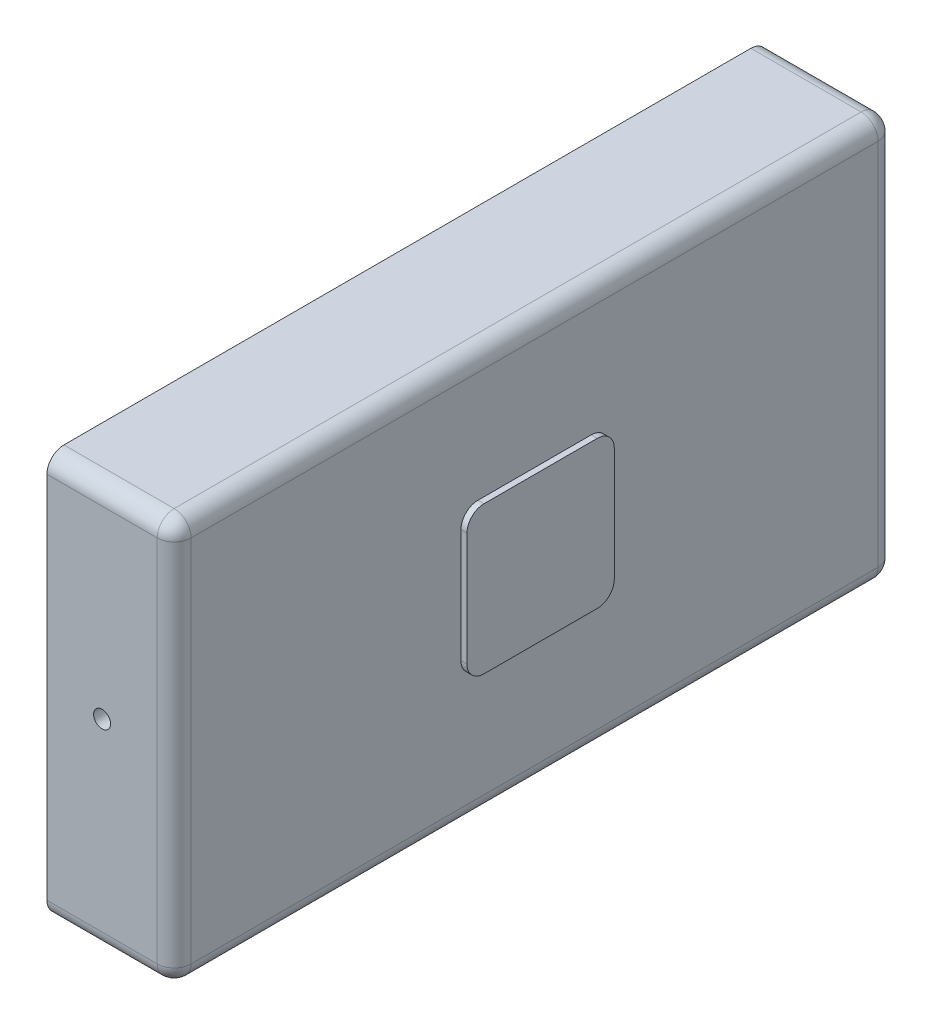
from build123d import *

# Parameters (mm, degrees)
SKETCH1_W           = 107.95
SKETCH1_H           = 60.325
BOSS_EXTRUDE1_DEPTH = 19.05
FILLET1_R           = 2.54
SKETCH5_R           = 1.27
CUT_EXTRUDE2_DEPTH  = 2.54
CUT_EXTRUDE3_START  = -2.54
SKETCH6_R           = 1.27
CUT_EXTRUDE3_DEPTH  = 2.54
BOSS_EXTRUDE3_DEPTH = 0.9017
SKETCH8_R           = 1.016
BOSS_EXTRUDE4_DEPTH = 3.048
SKETCH9_W           = 7.9375
SKETCH9_H           = 4.064
CUT_EXTRUDE4_DEPTH  = 4.064
BOSS_EXTRUDE5_DEPTH = 5.334


with BuildPart() as part:
    # Sketch1 → Boss-Extrude1 (new body)
    with BuildSketch(Plane(origin=(-20.290873615, 0, 0), x_dir=(0, 0, -1), z_dir=(1, 0, 0))):
        with Locations((-43.836998095, -3.355404983)):
            Rectangle(SKETCH1_W, SKETCH1_H)
    extrude(amount=BOSS_EXTRUDE1_DEPTH)

    # Fillet1
    fillet1_edges = [part.edges().sort_by_distance(p)[0] for p in [
        (-1.240873615, -3.355404983, -10.138001905),
        (-1.240873615, 26.807095017, 43.836998095),
        (-1.240873615, -3.355404983, 97.811998095),
        (-1.240873615, -33.517904983, 43.836998095),
        (-10.765873615, 26.807095017, 97.811998095),
        (-10.765873615, 26.807095017, -10.138001905),
        (-10.765873615, -33.517904983, -10.138001905),
        (-10.765873615, -33.517904983, 97.811998095),
    ]]
    fillet(fillet1_edges, radius=FILLET1_R)

    # Sketch5 → Cut-Extrude2 (cut)
    with BuildSketch(Plane(origin=(0, 0, -10.138001905), x_dir=(-1, 0, 0), z_dir=(0, 0, -1))):
        with Locations((12.035873615, -3.355404983)):
            Circle(SKETCH5_R)
    extrude(amount=-CUT_EXTRUDE2_DEPTH, mode=Mode.SUBTRACT)

    # Sketch6 → Cut-Extrude3 (cut)
    with BuildSketch(Plane.XY.offset(97.811998095).offset(CUT_EXTRUDE3_START)):
        with Locations(Location((-12.035873615, -3.355404983, 0), (0, 0, 180))):
            Circle(SKETCH6_R)
    extrude(amount=CUT_EXTRUDE3_DEPTH, mode=Mode.SUBTRACT)

    # Sketch7 → Boss-Extrude3 (add)
    with BuildSketch(Plane(origin=(-1.240873615, 0, 0), x_dir=(0, 0, -1), z_dir=(1, 0, 0))):
        with BuildLine():
            Line((-52.328218095, 7.674545017), (-35.345778095, 7.674545017))
            ThreePointArc((-35.345778095, 7.674545017), (-33.549726871, 6.930596241), (-32.805778095, 5.134545017))
            Line((-32.805778095, 5.134545017), (-32.805778095, -11.845354983))
            ThreePointArc((-32.805778095, -11.845354983), (-33.549726871, -13.641406207), (-35.345778095, -14.385354983))
            Line((-35.345778095, -14.385354983), (-52.328218095, -14.385354983))
            ThreePointArc((-52.328218095, -14.385354983), (-54.124269319, -13.641406207), (-54.868218095, -11.845354983))
            Line((-54.868218095, -11.845354983), (-54.868218095, 5.134545017))
            ThreePointArc((-54.868218095, 5.134545017), (-54.124269319, 6.930596241), (-52.328218095, 7.674545017))
        make_face()
    extrude(amount=BOSS_EXTRUDE3_DEPTH)

    # Sketch8 → Boss-Extrude4 (add)
    with BuildSketch(Plane.ZY.offset(20.290873615)):
        with Locations(Location((88.540998095, 21.281395003, 0), (0, 0, 180))):
            Circle(SKETCH8_R)
    extrude(amount=BOSS_EXTRUDE4_DEPTH)

    # Sketch9 → Cut-Extrude4 (cut)
    with BuildSketch(Plane.ZY.offset(20.290873615)):
        with Locations((92.336317085, -30.791056829)):
            Rectangle(SKETCH9_W, SKETCH9_H)
    extrude(amount=-CUT_EXTRUDE4_DEPTH, mode=Mode.SUBTRACT)

    # Sketch10 → Boss-Extrude5 (add)
    with BuildSketch(Plane.ZY.offset(16.226873615)):
        Polygon((88.868929932, -28.90840101), (88.868929932, -32.323313533), (95.680387965, -32.323313533), (95.680387965, -28.90840101), (96.013379651, -28.90840101), (96.013379651, -32.648312217), (88.518168835, -32.648312217), (88.518168835, -28.90840101), align=None)
    extrude(amount=BOSS_EXTRUDE5_DEPTH)


solid = part.part
